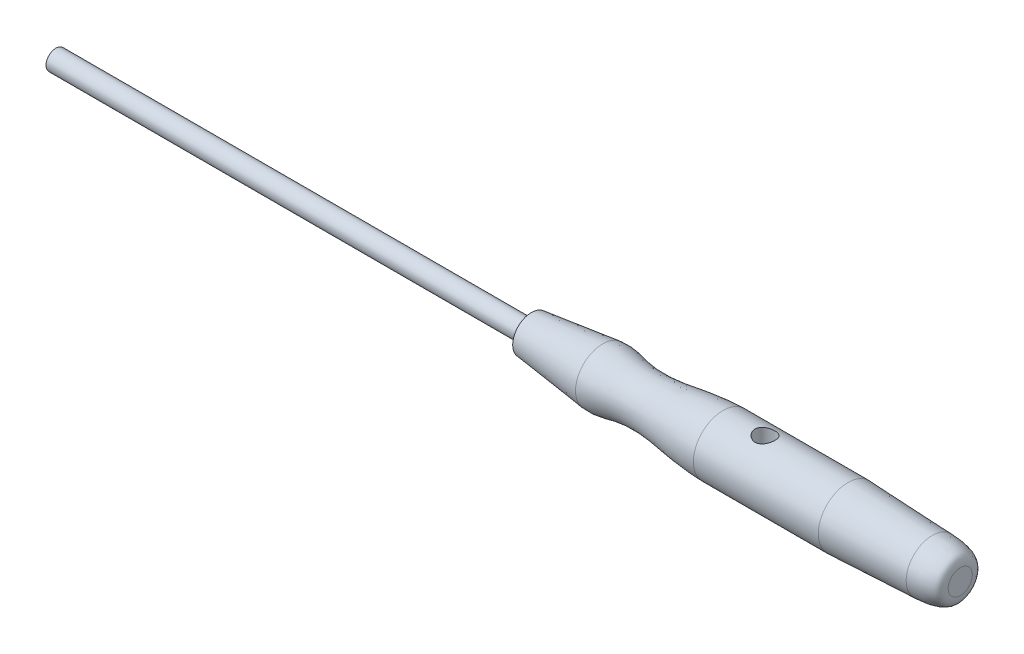
from build123d import *

# Parameters (mm, degrees)
CUT_EXTRUDE1_REACH      = 142.114
CUT_EXTRUDE1_END_RADIUS = 19.05
SKETCH3_R               = 6.35
SKETCH6_R               = 6.35
BOSS_EXTRUDE1_DEPTH     = 304.8


with BuildPart() as part:
    # Sketch1 → Revolve1 (revolve)
    with BuildSketch(Plane.XY, mode=Mode.PRIVATE) as revolve1_sk:
        with BuildLine():
            Line((-137.5, 0), (137.5, 0))
            Line((137.5, 0), (137.5, 7.747))
            add(Edge.make_bspline(
                [(119.602, 16.764), (126.446685513, 16.474787936), (132.251729161, 15.730759902), (137.5, 12.322795174), (137.5, 7.747)],
                knots=[0, 0, 0, 0, 0.656247862, 1, 1, 1, 1], degree=3))
            Line((119.602, 16.764), (65.5, 19.05))
            Line((65.5, 19.05), (-14.564, 19.05))
            add(Edge.make_bspline(
                [(-91.78, 17.399), (-84.901336541, 18.220618135), (-60.549292723, 10.012805319), (-35.82944709, 19.05), (-14.564, 19.05)],
                knots=[0, 0, 0, 0, 0.244238151, 1, 1, 1, 1], degree=3))
            Line((-91.78, 17.399), (-137.5, 11.938))
            Line((-137.5, 11.938), (-137.5, 0))
        make_face()
    revolve(revolve1_sk.sketch.rotate(Axis((-137.5, 0, 0), (1, 0, 0)), 180), axis=Axis((-137.5, 0, 0), (1, 0, 0)))

    # Cut-Extrude1: up to this cylinder (the profile starts inside it)
    cut_extrude1_end = Plane(origin=(12.36, 0, 0), z_dir=(-1, 0, 0)) * Cylinder(CUT_EXTRUDE1_END_RADIUS, 323.328, mode=Mode.PRIVATE)
    # Sketch3 → Cut-Extrude1 (cut, up to the surface)
    with BuildSketch(Plane(origin=(0, 0, 0), x_dir=(1, 0, 0), z_dir=(0, 1, 0)), mode=Mode.PRIVATE) as cut_extrude1_sk1:
        with Locations(Location((12.36, 0, 0), (0, 0, 90))):
            Circle(SKETCH3_R)
    cut_extrude1_tool1 = extrude(cut_extrude1_sk1.sketch, amount=CUT_EXTRUDE1_REACH, mode=Mode.PRIVATE) & cut_extrude1_end
    add(cut_extrude1_tool1.solids().sort_by_distance((12.36, 0, 0))[0], mode=Mode.SUBTRACT)

    # Sketch6 → Boss-Extrude1 (add)
    with BuildSketch(Plane.ZY.offset(137.5)):
        with Locations(Location((0, 0, 0), (0, 0, 90))):
            Circle(SKETCH6_R)
    extrude(amount=BOSS_EXTRUDE1_DEPTH)


solid = part.part
